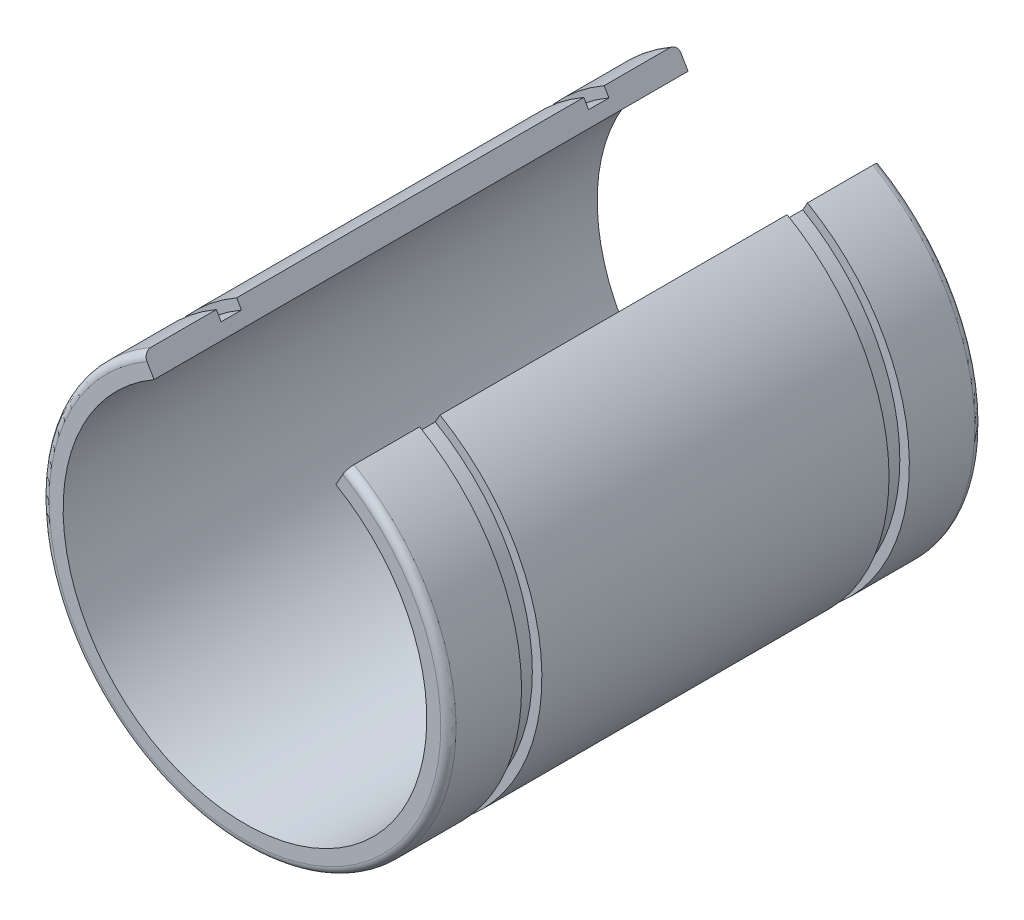
from build123d import *

# Parameters (mm, degrees)
BOSS_EXTRUDE1_DEPTH = 42
SKETCH2_W           = 0.75
SKETCH2_H           = 1.6
FILLET1_R           = 0.6


with BuildPart() as part:
    # Sketch1 → Boss-Extrude1 (new body)
    with BuildSketch(Plane.XY):
        with BuildLine():
            Line((-8, 13.856406461), (-7.15, 12.384163274))
            ThreePointArc((-7.15, 12.384163274), (0, -14.3), (7.15, 12.384163274))
            Line((7.15, 12.384163274), (7.986524529, 13.864177795))
            ThreePointArc((7.986524529, 13.864177795), (0.007777885, -15.99999811), (-8, 13.856406461))
        make_face()
    extrude(amount=BOSS_EXTRUDE1_DEPTH)

    # Sketch2 → Cut-Revolve1 (revolve, cut)
    with BuildSketch(Plane(origin=(0, 0, 0), x_dir=(1, 0, 0), z_dir=(0, 1, 0))):
        with Locations((15.625, -35.45)):
            Rectangle(SKETCH2_W, SKETCH2_H)
        with Locations((15.625, -6.55)):
            Rectangle(SKETCH2_W, SKETCH2_H)
    revolve(axis=Axis((0, 0, 0), (0, 0, 1)), mode=Mode.SUBTRACT)

    # Fillet1
    fillet1_edges = [part.edges().sort_by_distance(p)[0] for p in [
        (0.007777885, -15.99999811, 42),
        (0.007777885, -15.99999811, 0),
    ]]
    fillet(fillet1_edges, radius=FILLET1_R)


solid = part.part
